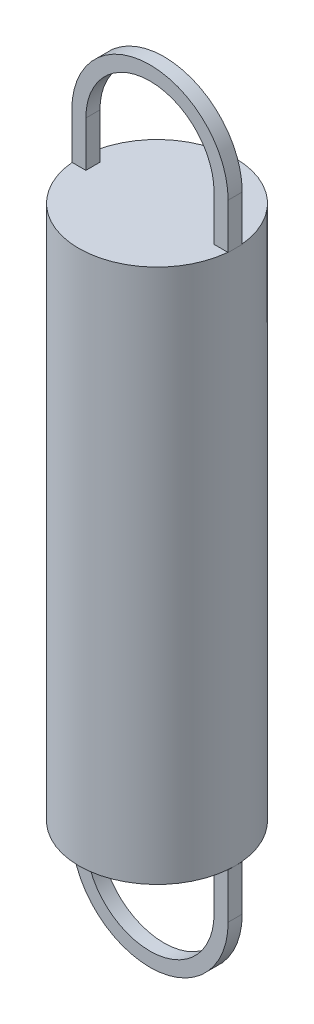
from build123d import *

# Parameters (mm, degrees)
BOSS_EXTRU_1_DEPTH = 0.225


with BuildPart() as part:
    # Esquisse8 → Révolution2 (revolve)
    with BuildSketch(Plane.XY):
        Polygon((-2.05, 8.55), (-2.5, 8.55), (-2.5, -8.55), (-2.05, -8.55), (0, -8.55), (0, 8.55), align=None)
    revolve(axis=Axis((0, 8.55, 0), (0, -1, 0)))

    # Esquisse8<4> → Boss.-Extru.1 (add, symmetric)
    with BuildSketch(Plane.XY):
        with BuildLine():
            ThreePointArc((2.5, 10), (0, 12.5), (-2.5, 10))
            Line((-2.5, 10), (-2.5, 8.55))
            Line((-2.5, 8.55), (-2.05, 8.55))
            Line((-2.05, 8.55), (-2.05, 10))
            ThreePointArc((-2.05, 10), (0, 12.05), (2.05, 10))
            Line((2.05, 10), (2.05, 8.55))
            Line((2.05, 8.55), (2.5, 8.55))
            Line((2.5, 8.55), (2.5, 10))
        make_face()
        with BuildLine():
            Line((-2.05, -8.55), (-2.5, -8.55))
            Line((-2.5, -8.55), (-2.5, -10))
            ThreePointArc((-2.5, -10), (0, -12.5), (2.5, -10))
            Line((2.5, -10), (2.5, -8.55))
            Line((2.5, -8.55), (2.05, -8.55))
            Line((2.05, -8.55), (2.05, -10))
            ThreePointArc((2.05, -10), (0, -12.05), (-2.05, -10))
            Line((-2.05, -10), (-2.05, -8.55))
        make_face()
    extrude(amount=BOSS_EXTRU_1_DEPTH, both=True)


solid = part.part
